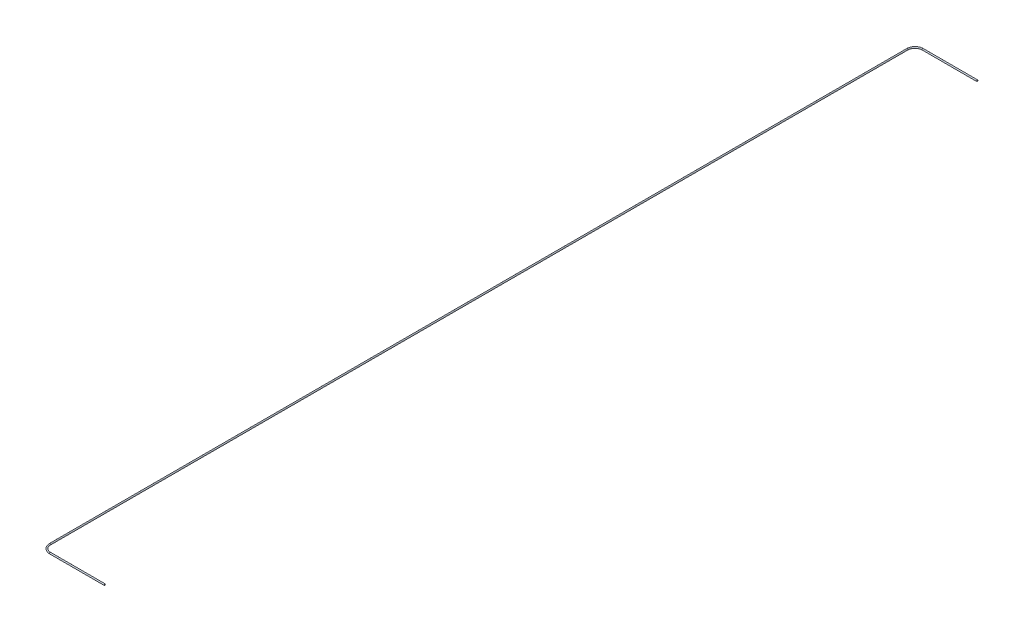
from build123d import *

# Parameters (mm, degrees)
SWEEP1_PROFILE_R = 6.35


with BuildPart() as part:
    # Sweep1: sweep along a path in Sketch1
    with BuildLine(Plane(origin=(0, 0, 0), x_dir=(1, 0, 0), z_dir=(0, 1, 0))) as sweep1_path:
        Line((600, 4200), (75, 4200))
        ThreePointArc((75, 4200), (21.966991411, 4178.033008589), (0, 4125))
        Line((0, 4125), (0, -4125))
        ThreePointArc((0, -4125), (21.966991411, -4178.033008589), (75, -4200))
        Line((75, -4200), (600, -4200))
    # Sweep1 profile (on start of the path) → Sweep1 (sweep)
    with BuildSketch(Plane(origin=(600, 0, -4200), x_dir=(0, 0, -1), z_dir=(-1, 0, 0))):
        Circle(SWEEP1_PROFILE_R)
    sweep(path=sweep1_path.line)


solid = part.part
